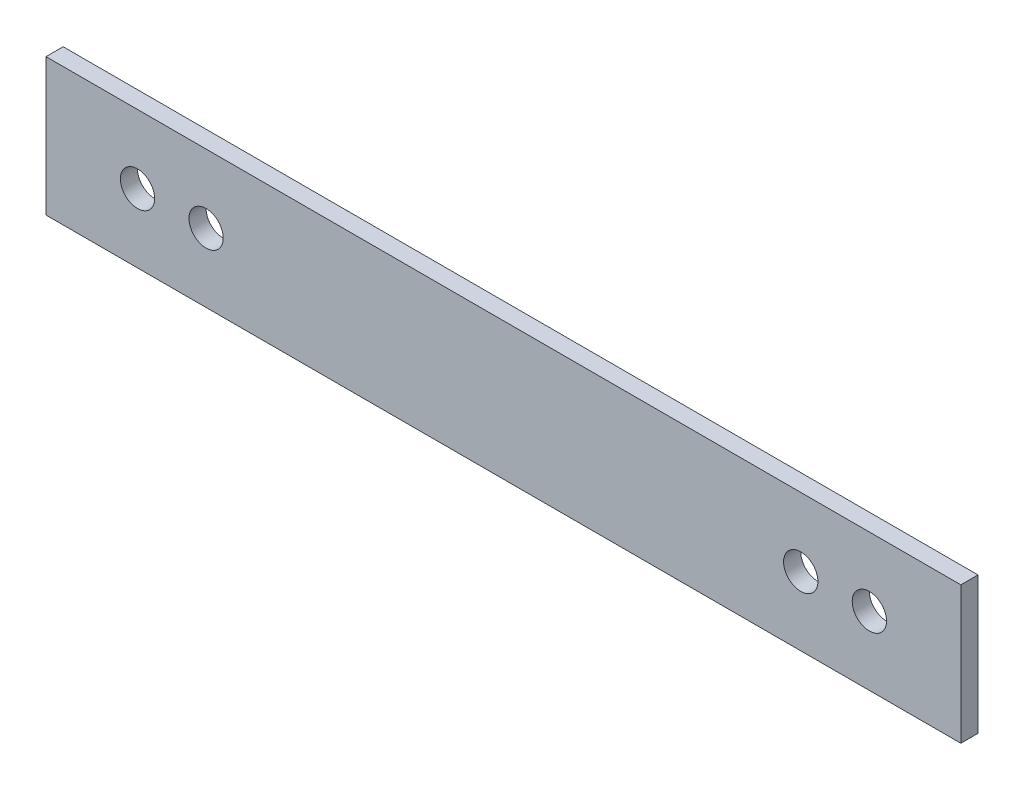
from build123d import *

# Parameters (mm, degrees)
SKETCH1_W           = 254
SKETCH1_H           = 38.1
SKETCH1_R           = 4.7625
BOSS_EXTRUDE1_DEPTH = 4.7625


with BuildPart() as part:
    # Sketch1 → Boss-Extrude1 (new body)
    with BuildSketch(Plane.XY):
        with Locations((127, 19.05)):
            Rectangle(SKETCH1_W, SKETCH1_H)
        with Locations(Location((209.55, 19.05, 0), (0, 0, 180))):
            Circle(SKETCH1_R, mode=Mode.SUBTRACT)
        with Locations(Location((228.6, 19.05, 0), (0, 0, 180))):
            Circle(SKETCH1_R, mode=Mode.SUBTRACT)
        with Locations(Location((25.4, 19.05, 0), (0, 0, 180))):
            Circle(SKETCH1_R, mode=Mode.SUBTRACT)
        with Locations(Location((44.45, 19.05, 0), (0, 0, 180))):
            Circle(SKETCH1_R, mode=Mode.SUBTRACT)
    extrude(amount=BOSS_EXTRUDE1_DEPTH)


solid = part.part
